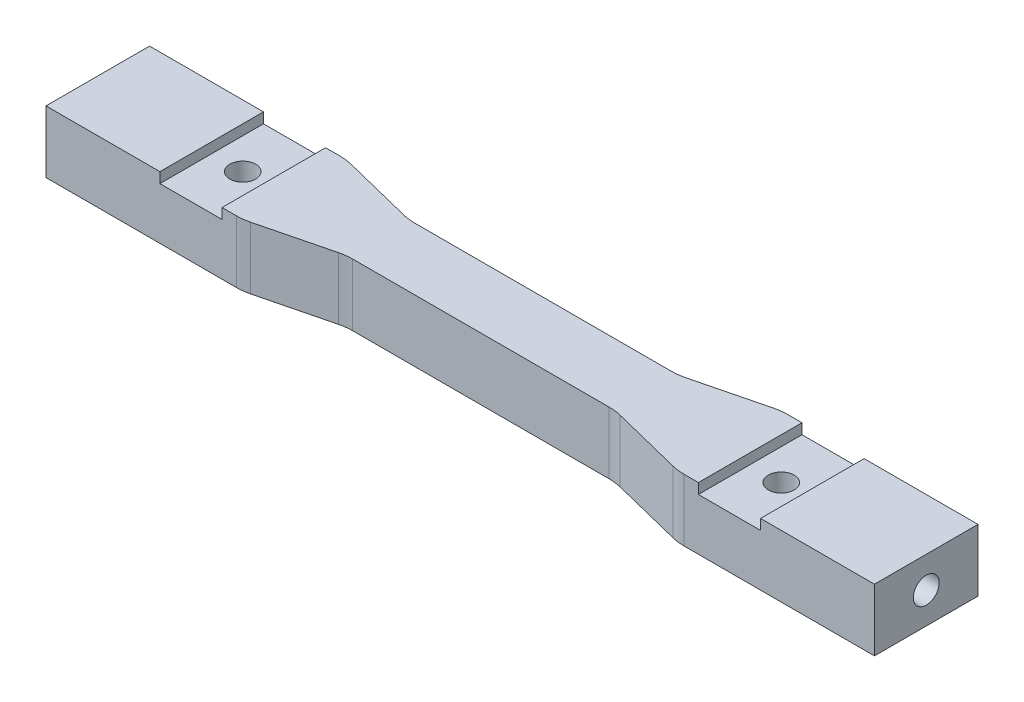
from build123d import *

# Parameters (mm, degrees)
SKETCH1_W                                 = 80
SKETCH1_H                                 = 10
BOSS_EXTRUDE1_DEPTH                       = 6
SKETCH2_W                                 = 6
SKETCH2_H                                 = 10
CUT_EXTRUDE1_DEPTH                        = 1
TAP_DRILL_FOR_M3X0_5_TAP1_D               = 2.5
TAP_DRILL_FOR_M3X0_5_TAP1_DEPTH           = 10
TAP_DRILL_FOR_M3X0_5_TAP1_TIP             = 0.751075774
TAP_DRILL_FOR_M3X0_5_TAP1_ON_FACE_2_D     = 2.5
TAP_DRILL_FOR_M3X0_5_TAP1_ON_FACE_2_DEPTH = 10
TAP_DRILL_FOR_M3X0_5_TAP1_ON_FACE_2_TIP   = 0.751075774
TAP_DRILL_FOR_M3X0_5_TAP1_ON_FACE_3_D     = 2.5
TAP_DRILL_FOR_M3X0_5_TAP1_ON_FACE_3_DEPTH = 10
TAP_DRILL_FOR_M3X0_5_TAP1_ON_FACE_3_TIP   = 0.751075774
CHAMFER1_SIZE                             = 1.5
CUT_EXTRUDE2_REACH                        = 82.846
FILLET1_R                                 = 5


with BuildPart() as part:
    # Sketch1 → Boss-Extrude1 (new body)
    with BuildSketch(Plane(origin=(0, 0, 0), x_dir=(1, 0, 0), z_dir=(0, 1, 0))):
        with Locations((40, 5)):
            Rectangle(SKETCH1_W, SKETCH1_H)
    extrude(amount=BOSS_EXTRUDE1_DEPTH)

    # Sketch2 → Cut-Extrude1 (cut)
    with BuildSketch(Plane(origin=(0, 6, 0), x_dir=(1, 0, 0), z_dir=(0, 1, 0))):
        with Locations((14, 5)):
            Rectangle(SKETCH2_W, SKETCH2_H)
        with Locations((66, 5)):
            Rectangle(SKETCH2_W, SKETCH2_H)
    extrude(amount=-CUT_EXTRUDE1_DEPTH, mode=Mode.SUBTRACT)

    # Tap Drill for M3x0.5 Tap1
    with Locations(Plane(origin=(80, 3, -5), x_dir=(0, 0, 1), z_dir=(1, 0, 0))):
        with Locations((0, 0)):
            Hole(TAP_DRILL_FOR_M3X0_5_TAP1_D / 2, depth=TAP_DRILL_FOR_M3X0_5_TAP1_DEPTH)
            with Locations((0, 0, -(TAP_DRILL_FOR_M3X0_5_TAP1_DEPTH + TAP_DRILL_FOR_M3X0_5_TAP1_TIP / 2))):  # 118° drill point
                Cone(0, TAP_DRILL_FOR_M3X0_5_TAP1_D / 2, TAP_DRILL_FOR_M3X0_5_TAP1_TIP, mode=Mode.SUBTRACT)

    # Tap Drill for M3x0.5 Tap1 on face 2
    with Locations(Plane(origin=(66, 0, -5), x_dir=(0, 0, -1), z_dir=(0, -1, 0))):
        with Locations((0, 0), (0, -52)):
            Hole(TAP_DRILL_FOR_M3X0_5_TAP1_ON_FACE_2_D / 2, depth=TAP_DRILL_FOR_M3X0_5_TAP1_ON_FACE_2_DEPTH)
            with Locations((0, 0, -(TAP_DRILL_FOR_M3X0_5_TAP1_ON_FACE_2_DEPTH + TAP_DRILL_FOR_M3X0_5_TAP1_ON_FACE_2_TIP / 2))):  # 118° drill point
                Cone(0, TAP_DRILL_FOR_M3X0_5_TAP1_ON_FACE_2_D / 2, TAP_DRILL_FOR_M3X0_5_TAP1_ON_FACE_2_TIP, mode=Mode.SUBTRACT)

    # Tap Drill for M3x0.5 Tap1 on face 3
    with Locations(Plane(origin=(0, 3, -5), x_dir=(0, 0, -1), z_dir=(-1, 0, 0))):
        with Locations((0, 0)):
            Hole(TAP_DRILL_FOR_M3X0_5_TAP1_ON_FACE_3_D / 2, depth=TAP_DRILL_FOR_M3X0_5_TAP1_ON_FACE_3_DEPTH)
            with Locations((0, 0, -(TAP_DRILL_FOR_M3X0_5_TAP1_ON_FACE_3_DEPTH + TAP_DRILL_FOR_M3X0_5_TAP1_ON_FACE_3_TIP / 2))):  # 118° drill point
                Cone(0, TAP_DRILL_FOR_M3X0_5_TAP1_ON_FACE_3_D / 2, TAP_DRILL_FOR_M3X0_5_TAP1_ON_FACE_3_TIP, mode=Mode.SUBTRACT)

    # Chamfer1
    chamfer1_edges = [part.edges().sort_by_distance(p)[0] for p in [
        (14, 0, -6.25),
        (66, 0, -6.25),
    ]]
    chamfer(chamfer1_edges, length=CHAMFER1_SIZE)

    # Sketch6 → Cut-Extrude2 (cut, up to next)
    with BuildSketch(Plane(origin=(0, 6, 0), x_dir=(1, 0, 0), z_dir=(0, 1, 0)), mode=Mode.PRIVATE) as cut_extrude2_sk1:
        Polygon((19, 10), (27, 8), (53, 8), (61, 10), align=None)
    cut_extrude2_tool1 = extrude(cut_extrude2_sk1.sketch, amount=-CUT_EXTRUDE2_REACH, mode=Mode.PRIVATE) & part.part
    # Sketch6 → Cut-Extrude2 (cut, up to next)
    with BuildSketch(Plane(origin=(0, 6, 0), x_dir=(1, 0, 0), z_dir=(0, 1, 0)), mode=Mode.PRIVATE) as cut_extrude2_sk2:
        Polygon((19, 0), (27, 2), (53, 2), (61, 0), align=None)
    cut_extrude2_tool2 = extrude(cut_extrude2_sk2.sketch, amount=-CUT_EXTRUDE2_REACH, mode=Mode.PRIVATE) & part.part
    add(cut_extrude2_tool1.solids().sort_by_distance((40, 6, -9.078431))[0], mode=Mode.SUBTRACT)
    add(cut_extrude2_tool2.solids().sort_by_distance((40, 6, -0.921569))[0], mode=Mode.SUBTRACT)

    # Fillet1
    fillet1_edges = [part.edges().sort_by_distance(p)[0] for p in [
        (19, 3, -10),
        (61, 3, -10),
        (53, 3, -8),
        (27, 3, -8),
        (61, 3, 0),
        (19, 3, 0),
        (27, 3, -2),
        (53, 3, -2),
    ]]
    fillet(fillet1_edges, radius=FILLET1_R)


solid = part.part
